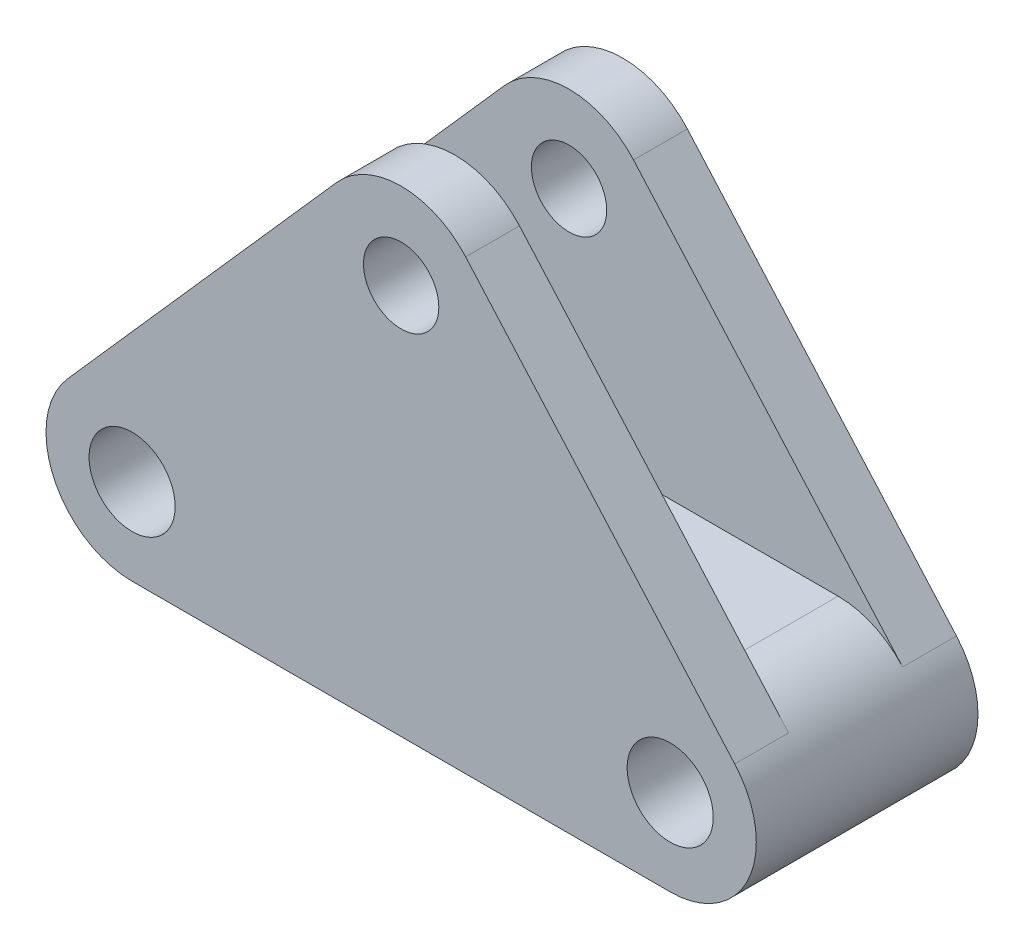
from build123d import *

# Parameters (mm, degrees)
SKETCH1_R           = 4
SKETCH1_R_2         = 3.5
BOSS_EXTRUDE1_DEPTH = 5
BOSS_EXTRUDE2_START = -5
SKETCH1_3_R         = 4
BOSS_EXTRUDE2_DEPTH = 10.6
BOSS_EXTRUDE3_START = -15.6
SKETCH1_4_R         = 4
SKETCH1_4_R_2       = 3.5
BOSS_EXTRUDE3_DEPTH = 5


with BuildPart() as part:
    # Sketch1 → Boss-Extrude1 (new body)
    # profile 1 of 2: a face of its own
    with BuildSketch(Plane.XY):
        with BuildLine():
            Line((-25, -36.3), (25, -36.3))
            ThreePointArc((25, -36.3), (32.292866569, -31.588479467), (30.995610492, -23.003524301))
            ThreePointArc((30.995610492, -23.003524301), (28.288479467, -21.007133431), (25, -20.3))
            Line((25, -20.3), (-25, -20.3))
            ThreePointArc((-25, -20.3), (-28.288479467, -21.007133431), (-30.995610492, -23.003524301))
            ThreePointArc((-30.995610492, -23.003524301), (-32.292866569, -31.588479467), (-25, -36.3))
        make_face()
        with Locations((-25, -28.3)):
            Circle(SKETCH1_R, mode=Mode.SUBTRACT)
        with Locations((25, -28.3)):
            Circle(SKETCH1_R, mode=Mode.SUBTRACT)
    # profile 2 of 2: a face of its own
    with BuildSketch(Plane.XY):
        with BuildLine():
            ThreePointArc((25, -20.3), (28.288479467, -21.007133431), (30.995610492, -23.003524301))
            Line((30.995610492, -23.003524301), (5.995610492, 5.296475699))
            ThreePointArc((5.995610492, 5.296475699), (0, 8), (-5.995610492, 5.296475699))
            Line((-5.995610492, 5.296475699), (-30.995610492, -23.003524301))
            ThreePointArc((-30.995610492, -23.003524301), (-28.288479467, -21.007133431), (-25, -20.3))
            Line((-25, -20.3), (25, -20.3))
        make_face()
        Circle(SKETCH1_R_2, mode=Mode.SUBTRACT)
    extrude(amount=-BOSS_EXTRUDE1_DEPTH)

    # Sketch1<3> → Boss-Extrude2 (add)
    with BuildSketch(Plane.XY.offset(BOSS_EXTRUDE2_START)):
        with BuildLine():
            Line((-25, -36.3), (25, -36.3))
            ThreePointArc((25, -36.3), (32.292866569, -31.588479467), (30.995610492, -23.003524301))
            ThreePointArc((30.995610492, -23.003524301), (28.288479467, -21.007133431), (25, -20.3))
            Line((25, -20.3), (-25, -20.3))
            ThreePointArc((-25, -20.3), (-28.288479467, -21.007133431), (-30.995610492, -23.003524301))
            ThreePointArc((-30.995610492, -23.003524301), (-32.292866569, -31.588479467), (-25, -36.3))
        make_face()
        with Locations((-25, -28.3)):
            Circle(SKETCH1_3_R, mode=Mode.SUBTRACT)
        with Locations((25, -28.3)):
            Circle(SKETCH1_3_R, mode=Mode.SUBTRACT)
    extrude(amount=-BOSS_EXTRUDE2_DEPTH)

    # Sketch1<4> → Boss-Extrude3 (add)
    # profile 1 of 2: a face of its own
    with BuildSketch(Plane.XY.offset(BOSS_EXTRUDE3_START)):
        with BuildLine():
            Line((-25, -36.3), (25, -36.3))
            ThreePointArc((25, -36.3), (32.292866569, -31.588479467), (30.995610492, -23.003524301))
            ThreePointArc((30.995610492, -23.003524301), (28.288479467, -21.007133431), (25, -20.3))
            Line((25, -20.3), (-25, -20.3))
            ThreePointArc((-25, -20.3), (-28.288479467, -21.007133431), (-30.995610492, -23.003524301))
            ThreePointArc((-30.995610492, -23.003524301), (-32.292866569, -31.588479467), (-25, -36.3))
        make_face()
        with Locations((-25, -28.3)):
            Circle(SKETCH1_4_R, mode=Mode.SUBTRACT)
        with Locations((25, -28.3)):
            Circle(SKETCH1_4_R, mode=Mode.SUBTRACT)
    # profile 2 of 2: a face of its own
    with BuildSketch(Plane.XY.offset(BOSS_EXTRUDE3_START)):
        with BuildLine():
            ThreePointArc((25, -20.3), (28.288479467, -21.007133431), (30.995610492, -23.003524301))
            Line((30.995610492, -23.003524301), (5.995610492, 5.296475699))
            ThreePointArc((5.995610492, 5.296475699), (0, 8), (-5.995610492, 5.296475699))
            Line((-5.995610492, 5.296475699), (-30.995610492, -23.003524301))
            ThreePointArc((-30.995610492, -23.003524301), (-28.288479467, -21.007133431), (-25, -20.3))
            Line((-25, -20.3), (25, -20.3))
        make_face()
        Circle(SKETCH1_4_R_2, mode=Mode.SUBTRACT)
    extrude(amount=-BOSS_EXTRUDE3_DEPTH)


solid = part.part
